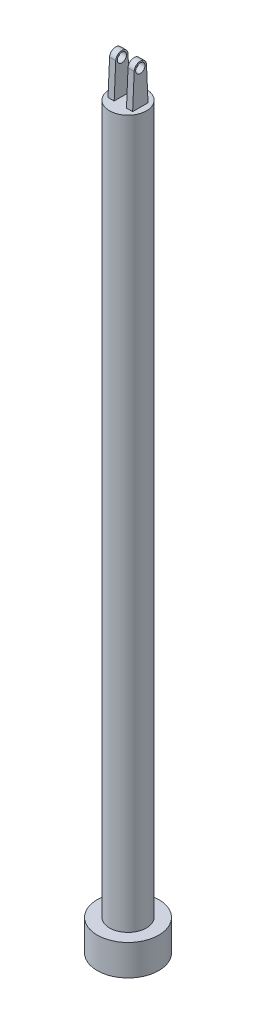
from build123d import *

# Parameters (mm, degrees)
SKETCH1_W           = 3
SKETCH1_H           = 10
SKETCH2_W           = 1
SKETCH2_H           = 2.5
BOSS_EXTRUDE2_DEPTH = 7
SKETCH3_R           = 0.75
CUT_EXTRUDE1_DEPTH  = 7


with BuildPart() as part:
    # Sketch1 → Revolve1 (revolve)
    with BuildSketch(Plane.XY, mode=Mode.PRIVATE) as revolve1_sk:
        Polygon((3, 110), (0, 110), (0, 0), (5, 0), (5, 5), (3, 5), align=None)
        with Locations((1.5, 115)):
            Rectangle(SKETCH1_W, SKETCH1_H)
    revolve(revolve1_sk.sketch.rotate(Axis((0, 0, 0), (0, 1, 0)), 90), axis=Axis((0, 0, 0), (0, 1, 0)))

    # Sketch2 → Boss-Extrude2 (add)
    with BuildSketch(Plane(origin=(0, 120, 0), x_dir=(1, 0, 0), z_dir=(0, 1, 0))):
        with Locations((-1.5, 0)):
            Rectangle(SKETCH2_W, SKETCH2_H)
        with Locations((1.5, 0)):
            Rectangle(SKETCH2_W, SKETCH2_H)
    extrude(amount=BOSS_EXTRUDE2_DEPTH)

    # Sketch3 → Cut-Extrude1 (cut)
    with BuildSketch(Plane.ZY.offset(2)):
        with Locations(Location((0, 125.5, 0), (0, 0, 180))):
            Circle(SKETCH3_R)
        with BuildLine():
            Line((1.25, 120), (0.99897696, 125.545222036))
            ThreePointArc((0.99897696, 125.545222036), (0, 126.5), (-0.99897696, 125.545222036))
            Line((-0.99897696, 125.545222036), (-1.25, 120))
            Line((-1.25, 120), (-1.25, 127))
            Line((-1.25, 127), (1.25, 127))
            Line((1.25, 127), (1.25, 120))
        make_face()
    extrude(amount=-CUT_EXTRUDE1_DEPTH, mode=Mode.SUBTRACT)


solid = part.part
